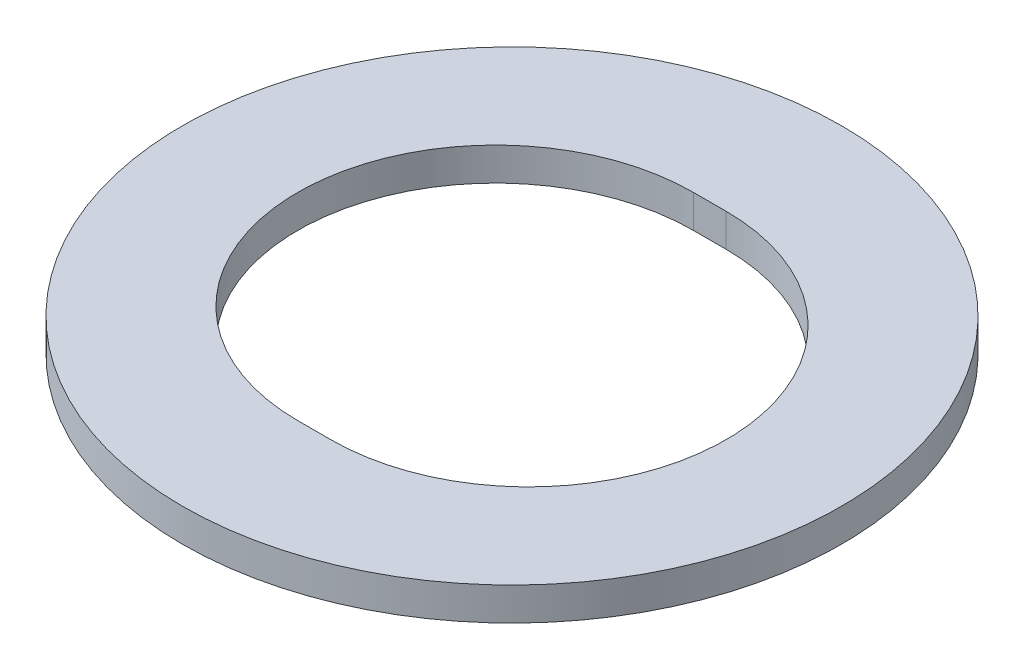
from build123d import *

# Parameters (mm, degrees)
SKETCH1_R           = 10
BOSS_EXTRUDE1_DEPTH = 1


with BuildPart() as part:
    # Sketch1 → Boss-Extrude1 (new body)
    with BuildSketch(Plane(origin=(0, 0, 0), x_dir=(1, 0, 0), z_dir=(0, 1, 0))):
        with Locations(Location((0, 0, 0), (0, 0, 270))):
            Circle(SKETCH1_R)
        with BuildLine():
            Line((-0.5, 6), (0.5, 6))
            ThreePointArc((0.5, 6), (6.5, 0), (0.5, -6))
            Line((0.5, -6), (-0.5, -6))
            ThreePointArc((-0.5, -6), (-6.5, 0), (-0.5, 6))
        make_face(mode=Mode.SUBTRACT)
    extrude(amount=BOSS_EXTRUDE1_DEPTH)


solid = part.part
